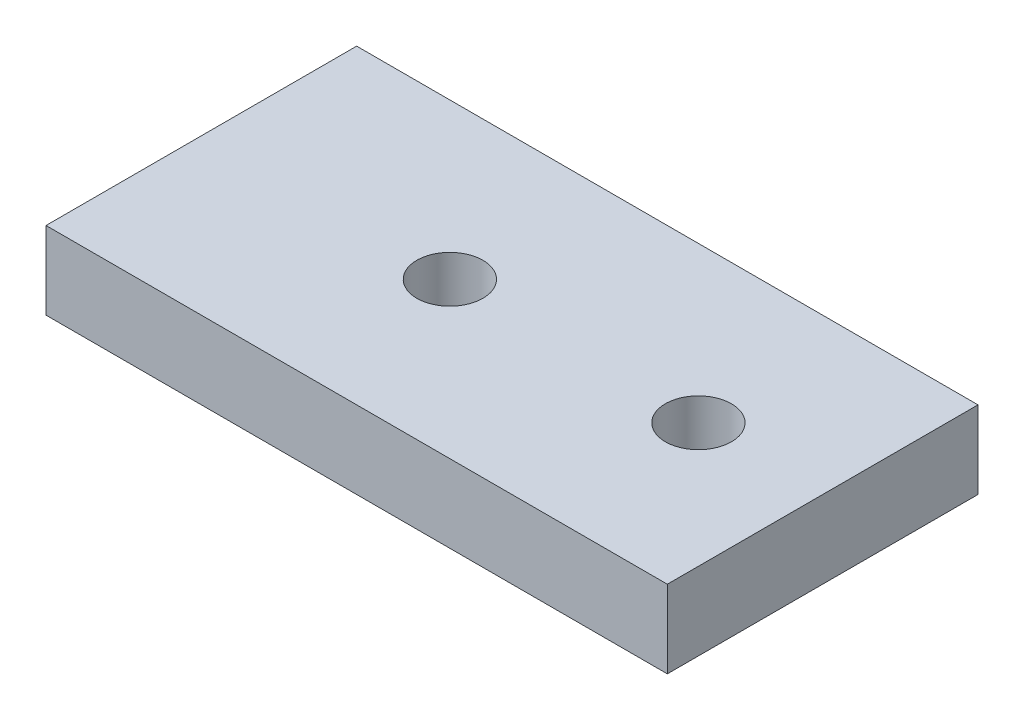
from build123d import *

# Parameters (mm, degrees)
SKETCH1_W           = 40
SKETCH1_H           = 20
SKETCH1_R           = 2.125
BOSS_EXTRUDE1_DEPTH = 5


with BuildPart() as part:
    # Sketch1 → Boss-Extrude1 (new body)
    with BuildSketch(Plane(origin=(0, 0, 0), x_dir=(1, 0, 0), z_dir=(0, 1, 0))):
        Rectangle(SKETCH1_W, SKETCH1_H)
        with Locations(Location((12, 0, 0), (0, 0, 270))):
            Circle(SKETCH1_R, mode=Mode.SUBTRACT)
        with Locations(Location((-4, 0, 0), (0, 0, 270))):
            Circle(SKETCH1_R, mode=Mode.SUBTRACT)
    extrude(amount=BOSS_EXTRUDE1_DEPTH)


solid = part.part
